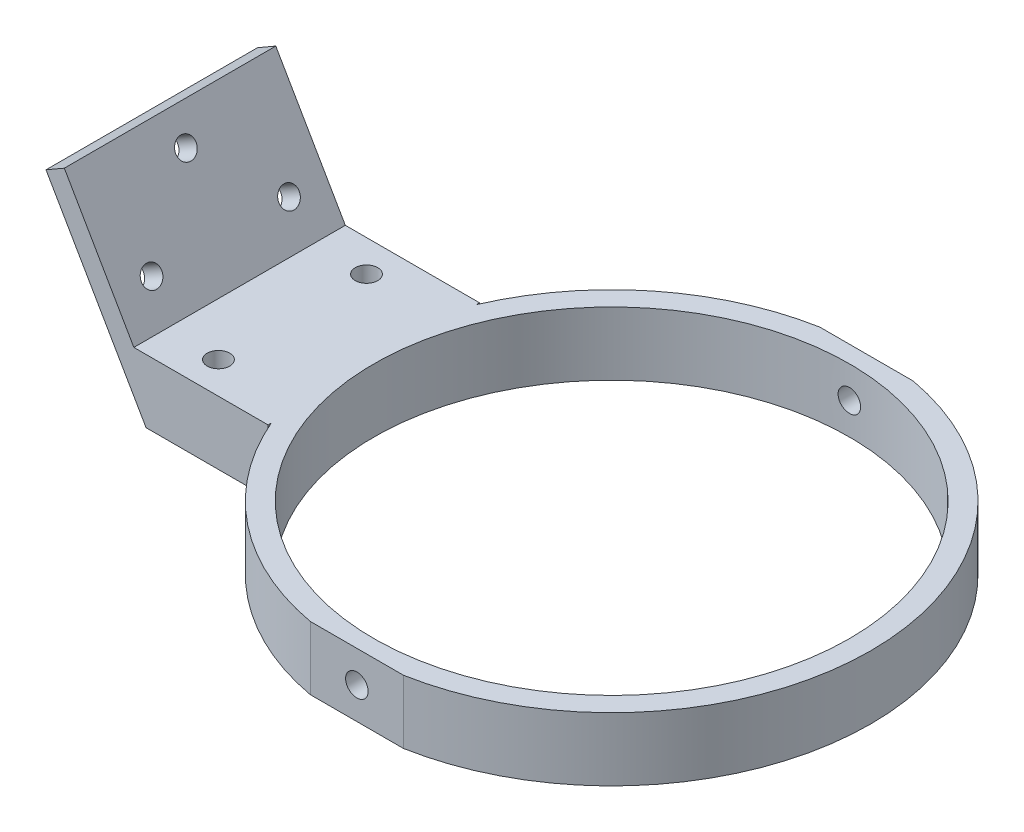
from build123d import *

# Parameters (mm, degrees)
SKETCH1_R                      = 31.115
SKETCH1_R_2                    = 28.575
EXTRUDE_THIN1_DEPTH            = 7.62
BOSS_EXTRUDE1_DEPTH            = 7.62
CUT_EXTRUDE1_REACH             = 67.161
CUT_EXTRUDE1_DIRECTION_2_DEPTH = 66.161025544
SKETCH4_W                      = 25.4
SKETCH4_H                      = 24.038818103
BOSS_EXTRUDE2_DEPTH            = 2.54
F_2_CLEARANCE_HOLE1_D          = 2.4384
F_6_32_TAPPED_HOLE1_D          = 2.7051
SKETCH9_W                      = 20.32
SKETCH9_H                      = 0.508
CUT_EXTRUDE2_DEPTH             = 66.034474296
CUT_EXTRUDE3_DEPTH             = 66.034474296
F_6_32_TAPPED_HOLE2_D          = 2.7051
F_6_32_TAPPED_HOLE2_DEPTH      = 11.176
F_6_32_TAPPED_HOLE2_TIP        = 0.81269403
F_6_32_TAPPED_HOLE3_D          = 2.7051
F_6_32_TAPPED_HOLE3_DEPTH      = 11.176
F_6_32_TAPPED_HOLE3_TIP        = 0.81269403


with BuildPart() as part:
    # Sketch1 → Extrude-Thin1 (new body)
    with BuildSketch(Plane(origin=(0, 0, 0), x_dir=(1, 0, 0), z_dir=(0, 1, 0))):
        Circle(SKETCH1_R)
        Circle(SKETCH1_R_2, mode=Mode.SUBTRACT)
    extrude(amount=EXTRUDE_THIN1_DEPTH)

    # Sketch2 → Boss-Extrude1 (add)
    with BuildSketch(Plane(origin=(0, 7.62, 0), x_dir=(1, 0, 0), z_dir=(0, 1, 0))):
        Polygon((-28.575, 0), (-28.575, -12.7), (-47.625, -12.7), (-47.625, 12.7), (-28.575, 12.7), align=None)
    extrude(amount=-BOSS_EXTRUDE1_DEPTH)

    # Sketch3 → Cut-Extrude1 (cut, up to next)
    with BuildSketch(Plane.XY.offset(12.7), mode=Mode.PRIVATE) as cut_extrude1_sk1:
        Polygon((-47.625, 0), (-43.225590949, 0), (-47.625, 7.62), align=None)
    cut_extrude1_tool1 = extrude(cut_extrude1_sk1.sketch, amount=-CUT_EXTRUDE1_REACH, mode=Mode.PRIVATE) & part.part
    add(cut_extrude1_tool1.solids().sort_by_distance((-46.15853, 2.54, 12.7))[0], mode=Mode.SUBTRACT)

    # Sketch3 → Cut-Extrude1 direction 2 (cut)
    with BuildSketch(Plane.XY.offset(12.7)):
        Polygon((-47.625, 0), (-43.225590949, 0), (-47.625, 7.62), align=None)
    extrude(amount=CUT_EXTRUDE1_DIRECTION_2_DEPTH, mode=Mode.SUBTRACT)

    # Sketch4 → Boss-Extrude2 (add)
    with BuildSketch(Plane(origin=(-32.419193212, -18.717229928, 0), x_dir=(0, 0, 1), z_dir=(-0.8660254037844413, -0.4999999999999954, 0))):
        with Locations((0, 33.632204526)):
            Rectangle(SKETCH4_W, SKETCH4_H)
    extrude(amount=-BOSS_EXTRUDE2_DEPTH)

    # #2 Clearance Hole1 (through all)
    with Locations(Plane(origin=(-30.219488686, -17.447229928, 0), x_dir=(0, 0, -1), z_dir=(0.8660254037844413, 0.4999999999999956, 0))):
        with Locations((-8.255, 33.586613577), (8.255, 33.586613577), (0, 41.841613577)):
            Hole(F_2_CLEARANCE_HOLE1_D / 2)

    # #6-32 Tapped Hole1 (through all)
    with Locations(Plane(origin=(0, 7.62, 0), x_dir=(1, 0, 0), z_dir=(0, 1, 0))):
        with Locations((-38.342060633, -8.89), (-38.342060633, 8.89)):
            Hole(F_6_32_TAPPED_HOLE1_D / 2)

    # Sketch9 → Cut-Extrude2 (cut, through all)
    with BuildSketch(Plane(origin=(0, 7.62, 0), x_dir=(1, 0, 0), z_dir=(0, 1, 0))):
        with Locations((0, 30.861)):
            Rectangle(SKETCH9_W, SKETCH9_H)
    extrude(amount=-CUT_EXTRUDE2_DEPTH, mode=Mode.SUBTRACT)

    # Sketch10 → Cut-Extrude3 (cut, through all)
    with BuildSketch(Plane(origin=(0, 7.62, 0), x_dir=(1, 0, 0), z_dir=(0, 1, 0))):
        Polygon((0, -31.115), (14.742648062, -31.115), (14.742648062, -30.607), (-16.079982159, -30.607), (-16.079982159, -31.115), align=None)
    extrude(amount=-CUT_EXTRUDE3_DEPTH, mode=Mode.SUBTRACT)

    # #6-32 Tapped Hole2
    with Locations(Plane(origin=(0, 0, -30.607), x_dir=(-1, 0, 0), z_dir=(0, 0, -1))):
        with Locations((0, 3.81)):
            Hole(F_6_32_TAPPED_HOLE2_D / 2, depth=F_6_32_TAPPED_HOLE2_DEPTH)
            with Locations((0, 0, -(F_6_32_TAPPED_HOLE2_DEPTH + F_6_32_TAPPED_HOLE2_TIP / 2))):  # 118° drill point
                Cone(0, F_6_32_TAPPED_HOLE2_D / 2, F_6_32_TAPPED_HOLE2_TIP, mode=Mode.SUBTRACT)

    # #6-32 Tapped Hole3
    with Locations(Plane.XY.offset(30.607)):
        with Locations((0, 3.81)):
            Hole(F_6_32_TAPPED_HOLE3_D / 2, depth=F_6_32_TAPPED_HOLE3_DEPTH)
            with Locations((0, 0, -(F_6_32_TAPPED_HOLE3_DEPTH + F_6_32_TAPPED_HOLE3_TIP / 2))):  # 118° drill point
                Cone(0, F_6_32_TAPPED_HOLE3_D / 2, F_6_32_TAPPED_HOLE3_TIP, mode=Mode.SUBTRACT)


solid = part.part
